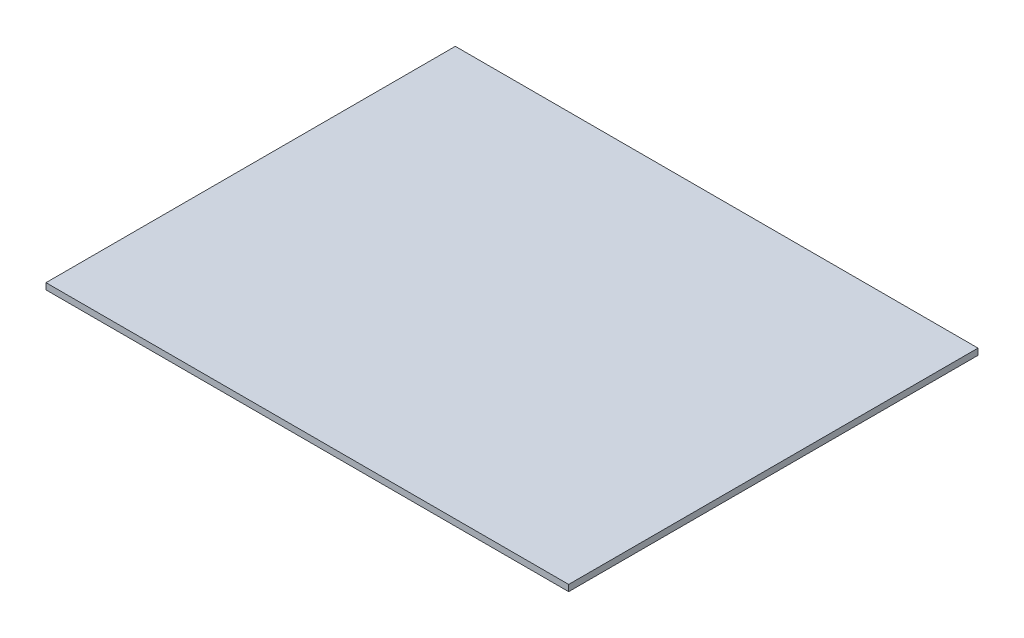
from build123d import *

# Parameters (mm, degrees)
SKETCH1_W           = 210.82
SKETCH1_H           = 165.1
BOSS_EXTRUDE1_DEPTH = 2.54


with BuildPart() as part:
    # Sketch1 → Boss-Extrude1 (new body)
    with BuildSketch(Plane(origin=(0, 0, 0), x_dir=(1, 0, 0), z_dir=(0, 1, 0))):
        Rectangle(SKETCH1_W, SKETCH1_H)
    extrude(amount=BOSS_EXTRUDE1_DEPTH)


solid = part.part
